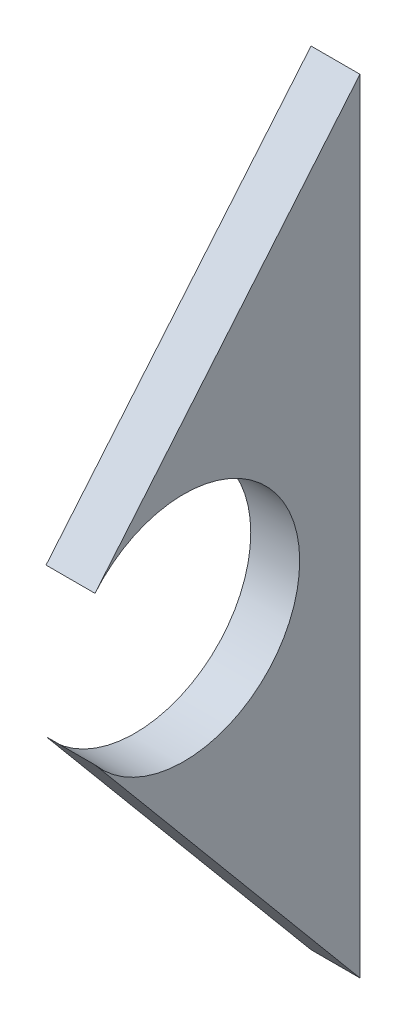
from build123d import *

# Parameters (mm, degrees)
BOSS_EXTRUDE1_DEPTH = 1.5875


with BuildPart() as part:
    # Sketch1 → Boss-Extrude1 (new body)
    with BuildSketch(Plane(origin=(0, 0, 0), x_dir=(0, 0, -1), z_dir=(1, 0, 0))):
        with BuildLine():
            Line((-2.884441741, 2.410721984), (5.715, 12.7))
            Line((5.715, 12.7), (5.715, -12.7))
            Line((5.715, -12.7), (-2.884441741, -2.410721984))
            ThreePointArc((-2.884441741, -2.410721984), (3.7592, 0), (-2.884441741, 2.410721984))
        make_face()
    extrude(amount=BOSS_EXTRUDE1_DEPTH)


solid = part.part
